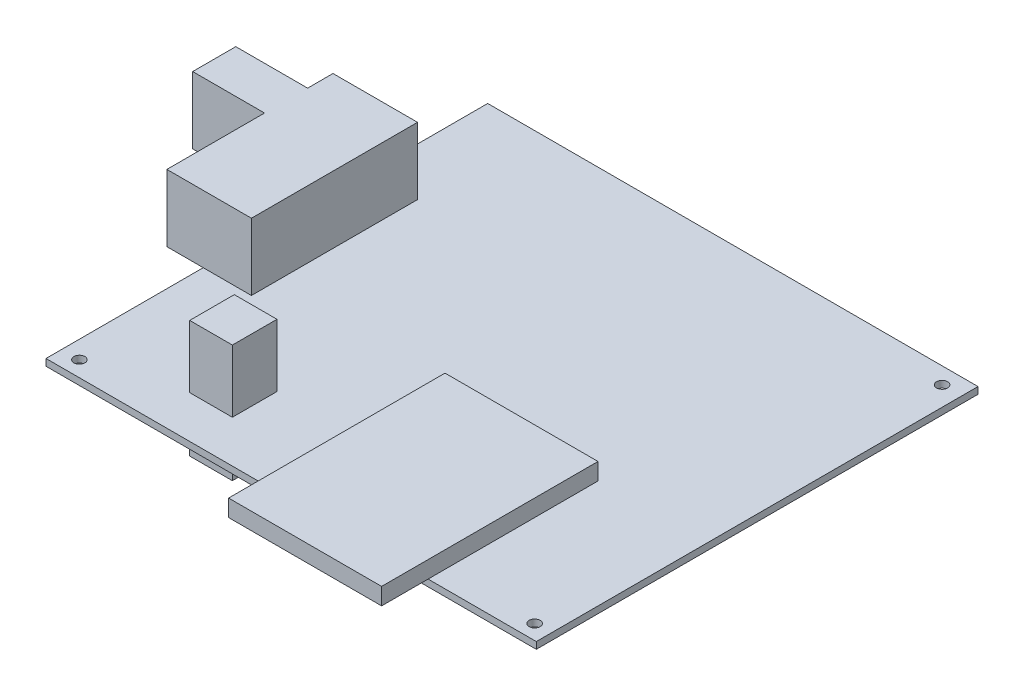
from build123d import *

# Parameters (mm, degrees)
SKETCH1_W                = 58
SKETCH1_H                = 52.25
SKETCH1_R                = 0.65
BOSS_EXTRUDE1_DEPTH      = 0.8
SKETCH1_3_W              = 5.7
SKETCH1_3_H              = 19.65
SKETCH1_3_W_2            = 8.5
SKETCH1_3_H_2            = 5.1
BOSS_EXTRUDE2_DEPTH      = 7.92
SKETCH1_4_W              = 18.1
SKETCH1_4_H              = 20.1
SKETCH1_4_H_2            = 5.5
BOSS_EXTRUDE3_DEPTH      = 2
BOSS_EXTRUDE4_DEPTH      = 8.2
BOSS_EXTRUDE4_DEPTH_BACK = 5.7
BOSS_EXTRUDE4_START      = -0.8
SKETCH1_5_W              = 5.047957292
SKETCH1_5_H              = 5.27600609


with BuildPart() as part:
    # Sketch1 → Boss-Extrude1 (new body)
    with BuildSketch(Plane(origin=(0, 0, 0), x_dir=(1, 0, 0), z_dir=(0, 1, 0))):
        with Locations((29, 26.125)):
            Rectangle(SKETCH1_W, SKETCH1_H)
        with Locations(Location((2.1, 1.85, 0), (0, 0, 270))):
            Circle(SKETCH1_R, mode=Mode.SUBTRACT)
        with Locations(Location((56.05, 1.75, 0), (0, 0, 270))):
            Circle(SKETCH1_R, mode=Mode.SUBTRACT)
        with Locations(Location((55.7, 50.3, 0), (0, 0, 270))):
            Circle(SKETCH1_R, mode=Mode.SUBTRACT)
    extrude(amount=-BOSS_EXTRUDE1_DEPTH)

    # Sketch1<3> → Boss-Extrude2 (add)
    with BuildSketch(Plane(origin=(0, 0, 0), x_dir=(1, 0, 0), z_dir=(0, 1, 0))):
        with Locations((2.85, 28.425)):
            Rectangle(SKETCH1_3_W, SKETCH1_3_H)
        Polygon((-4.3, 18.6), (0, 18.6), (0, 38.25), (-4.3, 38.25), (-4.3, 35.25), (-4.3, 30.15), align=None)
        with Locations((-8.55, 32.7)):
            Rectangle(SKETCH1_3_W_2, SKETCH1_3_H_2)
    extrude(amount=BOSS_EXTRUDE2_DEPTH)

    # Sketch1<4> → Boss-Extrude3 (add)
    with BuildSketch(Plane(origin=(0, 0, 0), x_dir=(1, 0, 0), z_dir=(0, 1, 0))):
        with Locations((36.15, 10.05)):
            Rectangle(SKETCH1_4_W, SKETCH1_4_H)
        with Locations((36.15, -2.75)):
            Rectangle(SKETCH1_4_W, SKETCH1_4_H_2)
    extrude(amount=BOSS_EXTRUDE3_DEPTH)

    # Sketch1<5> → Boss-Extrude4 (add, two sides: drawn at the far end of the back side and taken through both)
    with BuildSketch(Plane(origin=(0, 0, 0), x_dir=(1, 0, 0), z_dir=(0, 1, 0)).offset(BOSS_EXTRUDE4_START - BOSS_EXTRUDE4_DEPTH_BACK)):
        with Locations((14.523978646, 7.638003045)):
            Rectangle(SKETCH1_5_W, SKETCH1_5_H)
    extrude(amount=BOSS_EXTRUDE4_DEPTH + BOSS_EXTRUDE4_DEPTH_BACK)


solid = part.part
